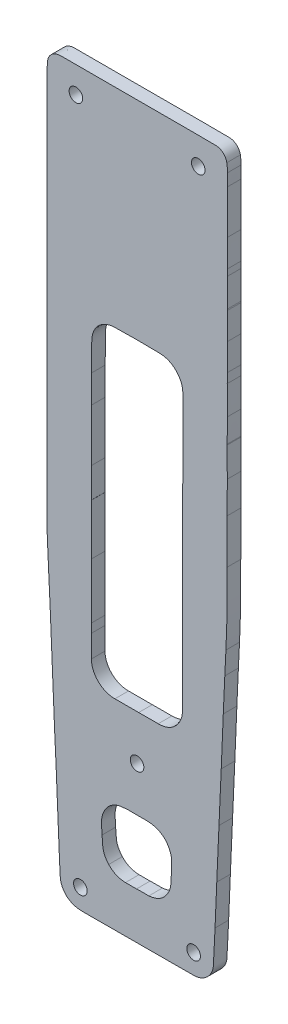
from build123d import *

# Parameters (mm, degrees)
MODEL_R             = 1.5
BOSS_EXTRUDE1_DEPTH = 3


with BuildPart() as part:
    # Model → Boss-Extrude1 (new body)
    with BuildSketch(Plane.XY):
        with BuildLine():
            add(Edge.make_bspline(
                [(173.665489307, 170.912422423), (173.744631039, 172.601417727), (173.848031881, 174.289339335), (173.919920676, 175.978613387)],
                knots=[65, 65, 65, 65, 66, 66, 66, 66], degree=3))
            add(Edge.make_bspline(
                [(173.919920676, 175.978613387), (174.009766171, 178.090417593), (174.121143178, 180.202614112), (174.146187506, 182.315553958), (174.18427059, 185.528350317), (174.15614738, 188.741910652), (174.15614738, 191.955150943)],
                knots=[66, 66, 66, 66, 67, 67, 67, 68, 68, 68, 68], degree=3))
            add(Edge.make_bspline(
                [(174.15614738, 191.955150943), (174.169744053, 191.955140619), (174.183340726, 191.955130295), (174.1969374, 191.955119971)],
                knots=[0, 0, 0, 0, 1, 1, 1, 1], degree=3))
            add(Edge.make_bspline(
                [(174.1969374, 191.955119971), (174.1969374, 195.224595064), (174.194561082, 198.494059833), (174.197722618, 201.763534926)],
                knots=[1, 1, 1, 1, 2, 2, 2, 2], degree=3))
            add(Edge.make_bspline(
                [(174.197722618, 201.763534926), (174.199995618, 204.102611565), (174.215100737, 206.44167788), (174.214563483, 208.780754518)],
                knots=[2, 2, 2, 2, 3, 3, 3, 3], degree=3))
            add(Edge.make_bspline(
                [(174.214563483, 208.780754518), (174.214088219, 210.950393746), (174.200450218, 213.120038136), (174.192804672, 215.289677364)],
                knots=[3, 3, 3, 3, 4, 4, 4, 4], degree=3))
            add(Edge.make_bspline(
                [(174.192804672, 215.289677364), (174.192598036, 215.346041217), (174.194685063, 215.402415393), (174.195201654, 215.458789569)],
                knots=[4, 4, 4, 4, 5, 5, 5, 5], degree=3))
            add(Edge.make_bspline(
                [(174.195201654, 215.458789569), (174.21096801, 217.205439225), (174.238595293, 218.95208888), (174.239421839, 220.698743697)],
                knots=[5, 5, 5, 5, 6, 6, 6, 6], degree=3))
            add(Edge.make_bspline(
                [(174.239421839, 220.698743697), (174.240413693, 222.811967453), (174.214997419, 224.925196371), (174.20892231, 227.038440775)],
                knots=[6, 6, 6, 6, 7, 7, 7, 7], degree=3))
            add(Edge.make_bspline(
                [(174.20892231, 227.038440775), (174.20687661, 227.742645655), (174.238843257, 228.446927965), (174.238367993, 229.151163817)],
                knots=[7, 7, 7, 7, 8, 8, 8, 8], degree=3))
            add(Edge.make_bspline(
                [(174.238367993, 229.151163817), (174.237024857, 231.122855922), (174.226651711, 233.094542864), (174.220721247, 235.066234969)],
                knots=[8, 8, 8, 8, 9, 9, 9, 9], degree=3))
            add(Edge.make_bspline(
                [(174.220721247, 235.066234969), (174.220390629, 235.178911053), (174.230515811, 235.291581976), (174.231425011, 235.404294194), (174.246592121, 237.291391482), (174.261263304, 239.178488769), (174.274880641, 241.06559638)],
                knots=[9, 9, 9, 9, 10, 10, 10, 11, 11, 11, 11], degree=3))
            add(Edge.make_bspline(
                [(174.274880641, 241.06559638), (174.27550055, 241.149958907), (174.260746713, 241.234378217), (174.260457422, 241.318797526)],
                knots=[11, 11, 11, 11, 12, 12, 12, 12], degree=3))
            add(Edge.make_bspline(
                [(174.260457422, 241.318797526), (174.253431785, 243.318751568), (174.247232694, 245.318700448), (174.241901475, 247.318654489), (174.241674175, 247.403047989), (174.254175676, 247.48739503), (174.256035403, 247.571871121)],
                knots=[12, 12, 12, 12, 13, 13, 13, 14, 14, 14, 14], degree=3))
            add(Edge.make_bspline(
                [(174.256035403, 247.571871121), (174.266615186, 248.050708347), (174.285543078, 248.529607516), (174.283662687, 249.008424093)],
                knots=[14, 14, 14, 14, 15, 15, 15, 15], degree=3))
            add(Edge.make_bspline(
                [(174.283662687, 249.008424093), (174.275789841, 251.008873686), (174.25198533, 253.00929747), (174.251902676, 255.009728996)],
                knots=[15, 15, 15, 15, 16, 16, 16, 16], degree=3))
            add(Edge.make_bspline(
                [(174.251902676, 255.009728996), (174.251820021, 257.658990073), (174.270892559, 260.308248569), (174.275934486, 262.957517388), (174.277008995, 263.520962336), (174.242376739, 264.084469227), (174.243409921, 264.647911594)],
                knots=[16, 16, 16, 16, 17, 17, 17, 18, 18, 18, 18], degree=3))
            add(Edge.make_bspline(
                [(174.243409921, 264.647911594), (174.245104339, 265.549544816), (174.284385914, 266.451575513), (174.266449877, 267.352617687)],
                knots=[18, 18, 18, 18, 19, 19, 19, 19], degree=3))
            add(Edge.make_bspline(
                [(174.266449877, 267.352617687), (174.254134349, 267.970728189), (174.209418237, 268.593427708), (174.112443786, 269.203482913)],
                knots=[19, 19, 19, 19, 20, 20, 20, 20], degree=3))
            add(Edge.make_bspline(
                [(174.112443786, 269.203482913), (173.937774058, 270.302208949), (172.978629996, 271.218352547), (171.768526056, 271.284312552), (171.487014991, 271.299659171), (171.204946007, 271.31187762), (170.923093991, 271.312460926), (168.271876976, 271.317937805), (165.620659961, 271.320676245), (162.969442946, 271.324005733), (160.966785189, 271.326519626), (158.964117101, 271.332027478), (156.961459345, 271.330244008), (154.620331206, 271.32815856), (152.279213399, 271.316045933), (149.93808526, 271.314654775), (145.876182376, 271.312241541), (141.814279491, 271.315152907), (137.752376607, 271.314014687), (137.526946654, 271.313950162), (137.300297546, 271.309167571), (137.076283052, 271.286390257), (135.977948727, 271.174702695), (134.746251286, 270.28521049), (134.587637205, 268.993637385)],
                knots=[20, 20, 20, 20, 21, 21, 21, 22, 22, 22, 23, 23, 23, 24, 24, 24, 25, 25, 25, 26, 26, 26, 27, 27, 27, 28, 28, 28, 28], degree=3))
            add(Edge.make_bspline(
                [(134.587637205, 268.993637385), (134.539718229, 268.603527156), (134.491003704, 268.210482332), (134.487966149, 267.818433773), (134.475505976, 266.211891058), (134.484577312, 264.605201225), (134.478150921, 262.998593985)],
                knots=[28, 28, 28, 28, 29, 29, 29, 30, 30, 30, 30], degree=3))
            add(Edge.make_bspline(
                [(134.478150921, 262.998593985), (134.469007262, 260.715677299), (134.444810142, 258.432794167), (134.442247851, 256.149880063)],
                knots=[30, 30, 30, 30, 31, 31, 31, 31], degree=3))
            add(Edge.make_bspline(
                [(134.442247851, 256.149880063), (134.438383751, 252.711914786), (134.450771601, 249.273936603), (134.450007047, 245.835963583)],
                knots=[31, 31, 31, 31, 32, 32, 32, 32], degree=3))
            add(Edge.make_bspline(
                [(134.450007047, 245.835963583), (134.449635101, 244.145130608), (134.428868146, 242.454297633), (134.428351555, 240.763464658), (134.426956759, 236.225676421), (134.434519651, 231.687883021), (134.432773573, 227.150094784)],
                knots=[32, 32, 32, 32, 33, 33, 33, 34, 34, 34, 34], degree=3))
            add(Edge.make_bspline(
                [(134.432773573, 227.150094784), (134.431378778, 223.542255907), (134.419145904, 219.934417031), (134.416077354, 216.326578154)],
                knots=[34, 34, 34, 34, 35, 35, 35, 35], degree=3))
            add(Edge.make_bspline(
                [(134.416077354, 216.326578154), (134.413112122, 212.83153925), (134.417906086, 209.336505508), (134.414961518, 205.841461442), (134.413277431, 203.840268521), (134.398967862, 201.8390756), (134.397459417, 199.837882679)],
                knots=[35, 35, 35, 35, 36, 36, 36, 37, 37, 37, 37], degree=3))
            add(Edge.make_bspline(
                [(134.397459417, 199.837882679), (134.394514848, 195.948420697), (134.394762812, 192.058969039), (134.397294108, 188.169507057)],
                knots=[37, 37, 37, 37, 38, 38, 38, 38], degree=3))
            add(Edge.make_bspline(
                [(134.397294108, 188.169507057), (134.398750894, 185.915840832), (134.400156021, 183.66213331), (134.415736404, 181.408539352), (134.422751709, 180.394196492), (134.456929365, 179.379832984), (134.492398499, 178.365954703)],
                knots=[38, 38, 38, 38, 39, 39, 39, 40, 40, 40, 40], degree=3))
            add(Edge.make_bspline(
                [(134.492398499, 178.365954703), (134.527857301, 177.352912667), (134.580322277, 176.340469421), (134.625410334, 175.327757752)],
                knots=[40, 40, 40, 40, 41, 41, 41, 41], degree=3))
            add(Edge.make_bspline(
                [(134.625410334, 175.327757752), (134.640463794, 174.989884359), (134.654008808, 174.651928373), (134.671242282, 174.31415822), (134.715741425, 173.442007747), (134.76359841, 172.570032781), (134.806568444, 171.69781004), (134.823202672, 171.360122478), (134.825826954, 171.021743209), (134.842368196, 170.684045323)],
                knots=[41, 41, 41, 41, 42, 42, 42, 43, 43, 43, 44, 44, 44, 44], degree=3))
            add(Edge.make_bspline(
                [(134.842368196, 170.684045323), (134.936160447, 168.77042053), (135.040821771, 166.857291289), (135.125108748, 164.94326386)],
                knots=[44, 44, 44, 44, 45, 45, 45, 45], degree=3))
            add(Edge.make_bspline(
                [(135.125108748, 164.94326386), (135.205707266, 163.113222133), (135.259660024, 161.282024118), (135.336456432, 159.451796559), (135.478229649, 156.073062623), (135.62604698, 152.694576464), (135.775331429, 149.316162573), (135.893506772, 146.641762567), (136.014368388, 143.967455478), (136.140116954, 141.293406488)],
                knots=[45, 45, 45, 45, 46, 46, 46, 47, 47, 47, 48, 48, 48, 48], degree=3))
            add(Edge.make_bspline(
                [(136.140116954, 141.293406488), (136.240707542, 139.154119806), (136.360298344, 137.01570034), (136.453512012, 134.876124586)],
                knots=[48, 48, 48, 48, 49, 49, 49, 49], degree=3))
            add(Edge.make_bspline(
                [(136.453512012, 134.876124586), (136.559020546, 132.454579873), (136.636798477, 130.031837577), (136.740643587, 127.610210272), (136.881889882, 124.316298282), (137.034811131, 121.022892168), (137.186099953, 117.729434434)],
                knots=[49, 49, 49, 49, 50, 50, 50, 51, 51, 51, 51], degree=3))
            add(Edge.make_bspline(
                [(137.186099953, 117.729434434), (137.237821038, 116.603334324), (137.272473958, 115.475479136), (137.362732727, 114.352290393)],
                knots=[51, 51, 51, 51, 52, 52, 52, 52], degree=3))
            add(Edge.make_bspline(
                [(137.362732727, 114.352290393), (137.538724927, 112.162137387), (139.031331787, 110.591320857), (141.209496149, 110.28261275)],
                knots=[52, 52, 52, 52, 53, 53, 53, 53], degree=3))
            add(Edge.make_bspline(
                [(141.209496149, 110.28261275), (141.681711925, 110.215692613), (142.163567288, 110.189283833), (142.640907646, 110.190068456)],
                knots=[53, 53, 53, 53, 54, 54, 54, 54], degree=3))
            add(Edge.make_bspline(
                [(142.640907646, 110.190068456), (148.056547415, 110.199029684), (153.472187183, 110.215651317), (158.88781662, 110.232871741), (161.511075733, 110.241213529), (164.134789447, 110.290871946), (166.757418319, 110.255832306)],
                knots=[54, 54, 54, 54, 55, 55, 55, 56, 56, 56, 56], degree=3))
            add(Edge.make_bspline(
                [(166.757418319, 110.255832306), (169.033559318, 110.225417816), (170.574167808, 111.959498007), (170.999694095, 113.408450097), (171.062687194, 113.622941423), (171.116350661, 113.846703697), (171.128221921, 114.068669595), (171.263692728, 116.601228229), (171.400455013, 119.133786863), (171.516429679, 121.667295305)],
                knots=[56, 56, 56, 56, 57, 57, 57, 58, 58, 58, 59, 59, 59, 59], degree=3))
            add(Edge.make_bspline(
                [(171.516429679, 121.667295305), (171.653047318, 124.651466789), (171.766149738, 127.636711968), (171.89567975, 130.621224144)],
                knots=[59, 59, 59, 59, 60, 60, 60, 60], degree=3))
            add(Edge.make_bspline(
                [(171.89567975, 130.621224144), (172.055771281, 134.310059925), (172.22175195, 137.998627283), (172.386172513, 141.687266908)],
                knots=[60, 60, 60, 60, 61, 61, 61, 61], degree=3))
            add(Edge.make_bspline(
                [(172.386172513, 141.687266908), (172.550593077, 145.375782646), (172.715344259, 149.064298384), (172.8817382, 152.752721205)],
                knots=[61, 61, 61, 61, 62, 62, 62, 62], degree=3))
            add(Edge.make_bspline(
                [(172.8817382, 152.752721205), (172.957925031, 154.441830073), (173.044567663, 156.130495009), (173.115185645, 157.819831005), (173.194048417, 159.706334662), (173.25376633, 161.593653915), (173.333259343, 163.480136925)],
                knots=[62, 62, 62, 62, 63, 63, 63, 64, 64, 64, 64], degree=3))
            add(Edge.make_bspline(
                [(173.333259343, 163.480136925), (173.437693367, 165.957833848), (173.549421655, 168.4352417), (173.665489307, 170.912422423)],
                knots=[64, 64, 64, 64, 65, 65, 65, 65], degree=3))
        make_face()
        with Locations((141.798791887, 114.605580456)):
            Circle(MODEL_R, mode=Mode.SUBTRACT)
        with BuildLine():
            add(Edge.make_bspline(
                [(151.752517942, 120.466717894), (152.569485847, 120.442064193), (153.387817551, 120.462257928), (154.205529346, 120.462257928)],
                knots=[15, 15, 15, 15, 16, 16, 16, 16], degree=3))
            add(Edge.make_bspline(
                [(148.059471319, 122.080564836), (149.05405352, 121.003834073), (150.310371685, 120.510181914), (151.752517942, 120.466717894)],
                knots=[14, 14, 14, 14, 15, 15, 15, 15], degree=3))
            add(Edge.make_bspline(
                [(146.582940769, 126.966891154), (146.631810272, 126.236272332), (146.669841697, 125.503423527), (146.759687193, 124.777378235), (146.888173691, 123.73909403), (147.351617753, 122.846853062), (148.059471319, 122.080564836)],
                knots=[12, 12, 12, 12, 13, 13, 13, 14, 14, 14, 14], degree=3))
            add(Edge.make_bspline(
                [(150.859425197, 134.526987714), (148.21120441, 134.206221181), (146.330544769, 131.731353032), (146.467069422, 129.075608486), (146.503210124, 128.37257538), (146.535972321, 127.669242877), (146.582940769, 126.966891154)],
                knots=[10, 10, 10, 10, 11, 11, 11, 12, 12, 12, 12], degree=3))
            add(Edge.make_bspline(
                [(156.26389627, 134.632158254), (154.968306861, 134.670800968), (153.670795735, 134.660580213), (152.374338454, 134.646539579), (151.868885217, 134.641067862), (151.362057848, 134.587878638), (150.859425197, 134.526987714)],
                knots=[8, 8, 8, 8, 9, 9, 9, 10, 10, 10, 10], degree=3))
            add(Edge.make_bspline(
                [(158.26918864, 134.388377753), (157.632531636, 134.578772874), (156.935784775, 134.612129703), (156.26389627, 134.632158254)],
                knots=[7, 7, 7, 7, 8, 8, 8, 8], degree=3))
            add(Edge.make_bspline(
                [(161.698928862, 131.058063356), (161.135400471, 132.766550363), (159.969496052, 133.87982807), (158.26918864, 134.388377753)],
                knots=[6, 6, 6, 6, 7, 7, 7, 7], degree=3))
            add(Edge.make_bspline(
                [(161.948958876, 129.141248448), (161.973775904, 129.793859162), (161.904934996, 130.433513261), (161.698928862, 131.058063356)],
                knots=[5, 5, 5, 5, 6, 6, 6, 6], degree=3))
            add(Edge.make_bspline(
                [(161.813643045, 125.763226869), (161.865798066, 126.888903694), (161.906154151, 128.015148339), (161.948958876, 129.141248448)],
                knots=[4, 4, 4, 4, 5, 5, 5, 5], degree=3))
            add(Edge.make_bspline(
                [(161.442617102, 123.779770571), (161.712938808, 124.41321995), (161.782265312, 125.086230878), (161.813643045, 125.763226869)],
                knots=[3, 3, 3, 3, 4, 4, 4, 4], degree=3))
            add(Edge.make_bspline(
                [(156.911205378, 120.496492296), (159.074905194, 120.665558043), (160.5892502, 121.780095278), (161.442617102, 123.779770571)],
                knots=[2, 2, 2, 2, 3, 3, 3, 3], degree=3))
            add(Edge.make_bspline(
                [(154.205581006, 120.484888126), (155.107755419, 120.484888126), (156.01451716, 120.426454312), (156.911205378, 120.496492296)],
                knots=[1, 1, 1, 1, 2, 2, 2, 2], degree=3))
            add(Edge.make_bspline(
                [(154.205529346, 120.462257928), (154.20555001, 120.469794445), (154.205560342, 120.477351609), (154.205581006, 120.484888126)],
                knots=[0, 0, 0, 0, 1, 1, 1, 1], degree=3))
        make_face(mode=Mode.SUBTRACT)
        with Locations((154.310810681, 144.489336388)):
            Circle(MODEL_R, mode=Mode.SUBTRACT)
        with BuildLine():
            add(Edge.make_bspline(
                [(144.216055406, 196.371642559), (144.210879165, 194.17370526), (144.214815588, 191.975747313), (144.214815588, 189.77779969)],
                knots=[34, 34, 34, 34, 35, 35, 35, 35], degree=3))
            add(Edge.make_bspline(
                [(144.254779063, 207.95396768), (144.247567454, 205.86861355), (144.251462549, 203.783228447), (144.244736535, 201.697874316), (144.239012708, 199.922456848), (144.220229461, 198.147060028), (144.216055406, 196.371642559)],
                knots=[32, 32, 32, 32, 33, 33, 33, 34, 34, 34, 34], degree=3))
            add(Edge.make_bspline(
                [(144.287634247, 214.125450741), (144.280990887, 212.068275955), (144.261887354, 210.011137304), (144.254779063, 207.95396768)],
                knots=[31, 31, 31, 31, 32, 32, 32, 32], degree=3))
            add(Edge.make_bspline(
                [(162.913465152, 223.856595754), (161.962297254, 224.825167181), (160.799347735, 225.326851408), (159.435650977, 225.370057328), (156.107885806, 225.475496292), (152.780337604, 225.466829298), (149.452696415, 225.37065612), (149.283636865, 225.36577287), (149.114350014, 225.355841186), (148.946024023, 225.339477654), (146.687881052, 225.119912084), (144.924683859, 223.591124539), (144.437497278, 221.382847759), (144.323444331, 220.865873695), (144.301861161, 220.321215838), (144.297149852, 219.788771267), (144.280453633, 217.901121647), (144.293719688, 216.01322425), (144.287634247, 214.125450741)],
                knots=[25, 25, 25, 25, 26, 26, 26, 27, 27, 27, 28, 28, 28, 29, 29, 29, 30, 30, 30, 31, 31, 31, 31], degree=3))
            add(Edge.make_bspline(
                [(164.405359116, 220.370760691), (164.389262143, 221.734534658), (163.860335013, 222.892406863), (162.913465152, 223.856595754)],
                knots=[24, 24, 24, 24, 25, 25, 25, 25], degree=3))
            add(Edge.make_bspline(
                [(164.373557778, 182.915512295), (164.377824819, 184.944528384), (164.358080714, 186.973585768), (164.359186218, 189.002622504), (164.361562537, 193.371076571), (164.369559364, 197.739540962), (164.377173915, 202.107995029), (164.385914633, 207.124672111), (164.397000675, 212.141349194), (164.40640263, 217.158026276), (164.408407003, 218.228949793), (164.418005262, 219.299992035), (164.405359116, 220.370760691)],
                knots=[20, 20, 20, 20, 21, 21, 21, 22, 22, 22, 23, 23, 23, 24, 24, 24, 24], degree=3))
            add(Edge.make_bspline(
                [(164.344339395, 171.759248136), (164.345207268, 173.590219023), (164.328697021, 175.421220882), (164.333666626, 177.252160797), (164.338791208, 179.139975602), (164.369580028, 181.027707814), (164.373557778, 182.915512295)],
                knots=[18, 18, 18, 18, 19, 19, 19, 20, 20, 20, 20], degree=3))
            add(Edge.make_bspline(
                [(164.311918148, 169.561930276), (164.31840653, 170.294407418), (164.343998445, 171.026812291), (164.344339395, 171.759248136)],
                knots=[17, 17, 17, 17, 18, 18, 18, 18], degree=3))
            add(Edge.make_bspline(
                [(164.319739334, 168.125046937), (164.319842653, 168.60400805), (164.307661438, 169.083031107), (164.311918148, 169.561930276)],
                knots=[16, 16, 16, 16, 17, 17, 17, 17], degree=3))
            add(Edge.make_bspline(
                [(164.313405929, 165.758136808), (164.314222143, 166.547106851), (164.319584357, 167.336076894), (164.319739334, 168.125046937)],
                knots=[15, 15, 15, 15, 16, 16, 16, 16], degree=3))
            add(Edge.make_bspline(
                [(164.317135716, 164.069110532), (164.318354871, 164.63211929), (164.312827348, 165.195128049), (164.313405929, 165.758136808)],
                knots=[14, 14, 14, 14, 15, 15, 15, 15], degree=3))
            add(Edge.make_bspline(
                [(162.490904097, 155.662694135), (163.758297971, 156.800501655), (164.401391698, 158.212844857), (164.330773717, 159.930179528), (164.31806558, 160.239197355), (164.306700579, 160.548566197), (164.306896884, 160.85778018), (164.307568452, 161.92822363), (164.314811057, 162.998667081), (164.317135716, 164.069110532)],
                knots=[11, 11, 11, 11, 12, 12, 12, 13, 13, 13, 14, 14, 14, 14], degree=3))
            add(Edge.make_bspline(
                [(158.983148311, 154.425311681), (160.295278961, 154.430690482), (161.495185396, 154.768791004), (162.490904097, 155.662694135)],
                knots=[10, 10, 10, 10, 11, 11, 11, 11], degree=3))
            add(Edge.make_bspline(
                [(154.668270845, 154.416474341), (156.106563334, 154.417124752), (157.544866154, 154.419406355), (158.983148311, 154.425311681)],
                knots=[9, 9, 9, 9, 10, 10, 10, 10], degree=3))
            add(Edge.make_bspline(
                [(149.423385045, 154.412943534), (151.171063846, 154.446341659), (152.919930807, 154.415700041), (154.668270845, 154.416474341)],
                knots=[8, 8, 8, 8, 9, 9, 9, 9], degree=3))
            add(Edge.make_bspline(
                [(144.225736321, 159.427163506), (144.268189764, 156.483420788), (146.704887226, 154.361003514), (149.423385045, 154.412943534)],
                knots=[7, 7, 7, 7, 8, 8, 8, 8], degree=3))
            add(Edge.make_bspline(
                [(144.225343711, 164.3301734), (144.225984284, 162.69581268), (144.202179774, 161.061162887), (144.225736321, 159.427163506)],
                knots=[6, 6, 6, 6, 7, 7, 7, 7], degree=3))
            add(Edge.make_bspline(
                [(144.212687233, 166.274439811), (144.21073452, 165.626371656), (144.225085416, 164.978262204), (144.225343711, 164.3301734)],
                knots=[5, 5, 5, 5, 6, 6, 6, 6], degree=3))
            add(Edge.make_bspline(
                [(144.223959248, 178.532635607), (144.224217543, 176.447364069), (144.238785408, 174.362082206), (144.236967008, 172.276810667), (144.23522093, 170.276020382), (144.218741679, 168.275240421), (144.212687233, 166.274439811)],
                knots=[3, 3, 3, 3, 4, 4, 4, 5, 5, 5, 5], degree=3))
            add(Edge.make_bspline(
                [(144.233412862, 189.777706774), (144.233412862, 188.904121266), (144.23419808, 188.030535757), (144.233257885, 187.156950248), (144.230168671, 184.282182143), (144.223607966, 181.407403713), (144.223959248, 178.532635607)],
                knots=[1, 1, 1, 1, 2, 2, 2, 3, 3, 3, 3], degree=3))
            add(Edge.make_bspline(
                [(144.214815588, 189.77779969), (144.221014679, 189.777768718), (144.227213771, 189.777737746), (144.233412862, 189.777706774)],
                knots=[0, 0, 0, 0, 1, 1, 1, 1], degree=3))
        make_face(mode=Mode.SUBTRACT)
        with Locations((166.798765736, 114.641740824)):
            Circle(MODEL_R, mode=Mode.SUBTRACT)
        with Locations((140.811174136, 265.522550545)):
            Circle(MODEL_R, mode=Mode.SUBTRACT)
        with Locations((167.810652113, 265.354654694)):
            Circle(MODEL_R, mode=Mode.SUBTRACT)
    extrude(amount=BOSS_EXTRUDE1_DEPTH)


solid = part.part
